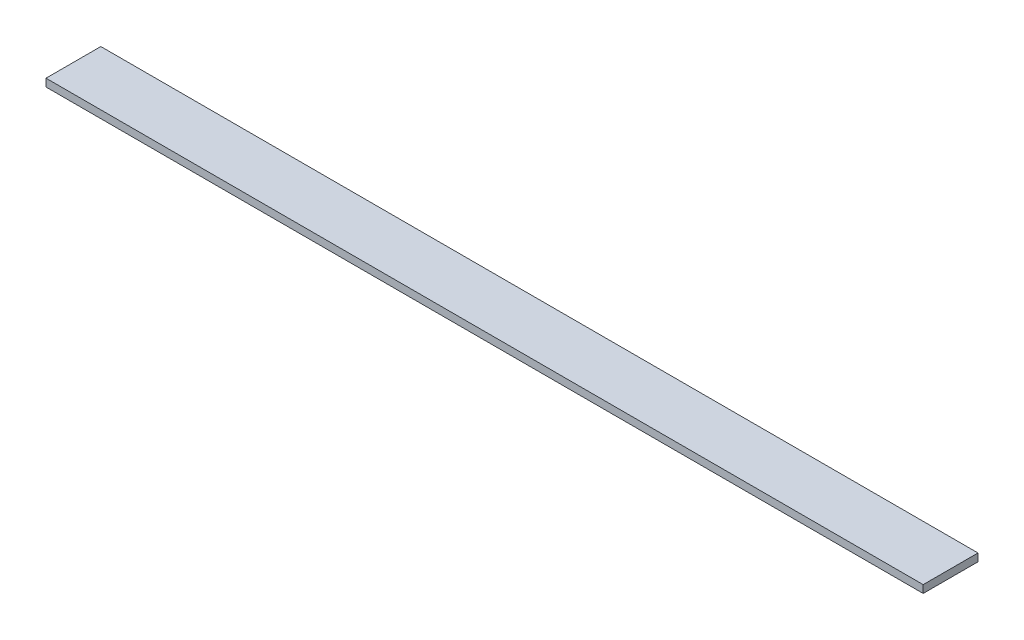
from build123d import *

# Parameters (mm, degrees)
SKETCH1_W           = 80
SKETCH1_H           = 5
BOSS_EXTRUDE1_DEPTH = 0.7


with BuildPart() as part:
    # Sketch1 → Boss-Extrude1 (new body)
    with BuildSketch(Plane(origin=(0, 0, 0), x_dir=(1, 0, 0), z_dir=(0, 1, 0))):
        Rectangle(SKETCH1_W, SKETCH1_H)
    extrude(amount=BOSS_EXTRUDE1_DEPTH)


solid = part.part
